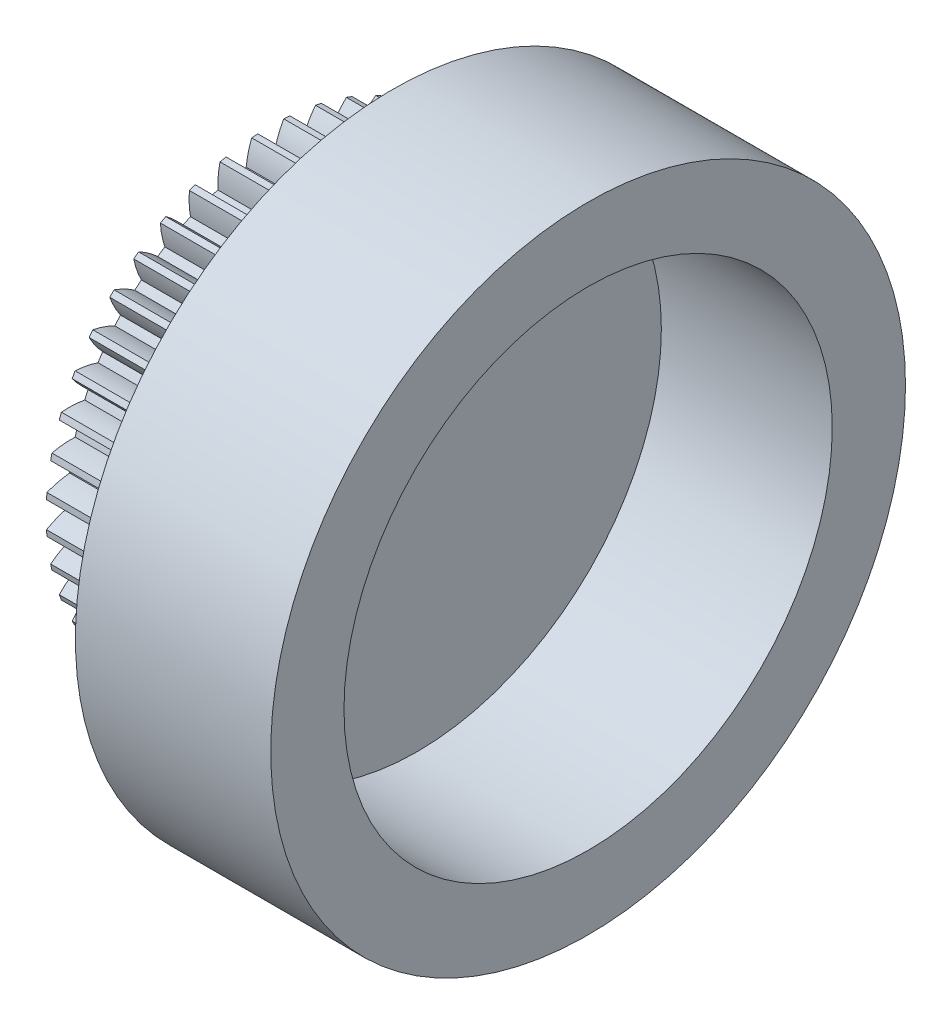
from build123d import *

# Parameters (mm, degrees)
BASPROSKE_W         = 5
BASPROSKE_H         = 9.2
TOOTHCUT_DEPTH      = 14.938436067
TEETHCUTS_COUNT     = 44
TEETHCUTS_ANGLE     = 351.818181818
BORSKE_R            = 7.5
BORE_DEPTH          = 50.0000508
SKETCH1_R           = 13
SKETCH1_R_2         = 10
BOSS_EXTRUDE1_DEPTH = 1
SKETCH2_R           = 13
SKETCH2_R_2         = 10
BOSS_EXTRUDE2_DEPTH = 7


with BuildPart() as part:
    # BasProSke → Base-Revolve (revolve)
    with BuildSketch(Plane(origin=(0, 0, 0), x_dir=(1, 0, 0), z_dir=(0, 1, 0)), mode=Mode.PRIVATE) as base_revolve_sk:
        with Locations((2.5, 4.6)):
            Rectangle(BASPROSKE_W, BASPROSKE_H)
    revolve(base_revolve_sk.sketch.rotate(Axis((-10, 0, 0), (1, 0, 0)), 180), axis=Axis((-10, 0, 0), (1, 0, 0)))

    # TooCutSke → ToothCut (cut, through all)
    with BuildSketch(Plane(origin=(0, 0, 0), x_dir=(0, 0, -1), z_dir=(1, 0, 0))):
        with BuildLine():
            ThreePointArc((0.177003636, 8.297112191), (0, 8.299), (-0.177003636, 8.297112191))
            ThreePointArc((-0.177003636, 8.297112191), (-0.329182518, 8.766121098), (-0.545405548, 9.209263703))
            ThreePointArc((-0.545405548, 9.209263703), (0, 9.2254), (0.545405548, 9.209263703))
            ThreePointArc((0.545405548, 9.209263703), (0.329182518, 8.766121098), (0.177003636, 8.297112191))
        make_face()
    toothcut = extrude(amount=TOOTHCUT_DEPTH, mode=Mode.SUBTRACT)

    # TeethCuts: ToothCut ×44 about axis
    teethcuts_axis = Axis((-10, 0, 0), (1, 0, 0))
    for i in range(1, TEETHCUTS_COUNT):
        add(toothcut.rotate(teethcuts_axis, i * TEETHCUTS_ANGLE / (TEETHCUTS_COUNT - 1)), mode=Mode.SUBTRACT)

    # BorSke → Bore (cut, symmetric)
    with BuildSketch(Plane(origin=(0, 0, 0), x_dir=(0, 0, -1), z_dir=(1, 0, 0))):
        with Locations(Location((0, 0, 0), (0, 0, 180))):
            Circle(BORSKE_R)
    extrude(amount=BORE_DEPTH, both=True, mode=Mode.SUBTRACT)

    # Sketch1 → Boss-Extrude1 (add)
    # profile 1 of 2: a face of its own
    with BuildSketch(Plane(origin=(5, 0, 0), x_dir=(0, 0, -1), z_dir=(1, 0, 0))):
        Circle(SKETCH1_R)
        Circle(SKETCH1_R_2, mode=Mode.SUBTRACT)
    # profile 2 of 2: a face of its own
    with BuildSketch(Plane(origin=(5, 0, 0), x_dir=(0, 0, -1), z_dir=(1, 0, 0))):
        Circle(SKETCH1_R_2)
    extrude(amount=BOSS_EXTRUDE1_DEPTH)

    # Sketch2 → Boss-Extrude2 (add)
    with BuildSketch(Plane(origin=(6, 0, 0), x_dir=(0, 0, -1), z_dir=(1, 0, 0))):
        Circle(SKETCH2_R)
        Circle(SKETCH2_R_2, mode=Mode.SUBTRACT)
    extrude(amount=BOSS_EXTRUDE2_DEPTH)


solid = part.part
